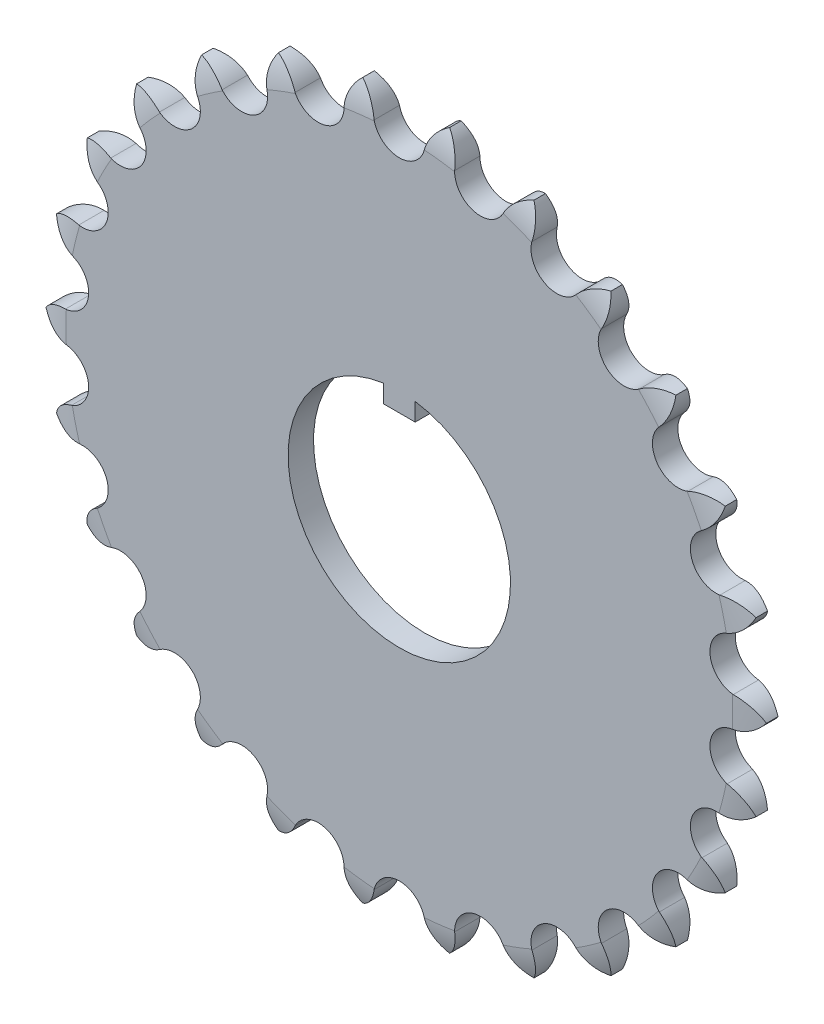
from build123d import *

# Parameters (mm, degrees)
SKETCH2_R                = 17.5
BOSS_EXTRUDE1_DEPTH      = 4
BOSS_EXTRUDE2_DEPTH      = 2
BOSS_EXTRUDE2_DEPTH_BACK = 2
SKETCH8_W                = 5
SKETCH8_H                = 7.950638129


with BuildPart() as part:
    # Sketch2 → Boss-Extrude1 (new body)
    with BuildSketch(Plane.XY):
        with BuildLine():
            ThreePointArc((3.964856262, 52.447805617), (0, 49.276), (-3.964856262, 52.447805617))
            ThreePointArc((-3.964856262, 52.447805617), (-4.989300963, 54.66856047), (-6.833064673, 56.275350576))
            ThreePointArc((-6.833064673, 56.275350576), (-8.23872192, 54.274009333), (-8.701936696, 51.872619916))
            ThreePointArc((-8.701936696, 51.872619916), (-11.792518673, 47.844128995), (-16.401226187, 49.974915495))
            ThreePointArc((-16.401226187, 49.974915495), (-17.927363809, 51.885973585), (-20.102081139, 53.004831753))
            ThreePointArc((-20.102081139, 53.004831753), (-20.987940231, 50.725250052), (-20.863004724, 48.282786095))
            ThreePointArc((-20.863004724, 48.282786095), (-22.899699026, 43.63173112), (-27.884416461, 44.597664937))
            ThreePointArc((-27.884416461, 44.597664937), (-29.823553434, 46.087962512), (-32.202837716, 46.653864773))
            ThreePointArc((-32.202837716, 46.653864773), (-32.517415745, 44.228523616), (-31.811590752, 41.886932246))
            ThreePointArc((-31.811590752, 41.886932246), (-32.676032107, 36.883615627), (-37.747065807, 36.628560198))
            ThreePointArc((-37.747065807, 36.628560198), (-39.986506538, 37.611486582), (-42.432082418, 37.591544753))
            ThreePointArc((-42.432082418, 37.591544753), (-42.157097251, 35.161396152), (-40.911402755, 33.056762149))
            ThreePointArc((-40.911402755, 33.056762149), (-40.553352976, 27.99195846), (-45.415992893, 26.53073668))
            ThreePointArc((-45.415992893, 26.53073668), (-47.825589226, 26.949167763), (-50.195328724, 26.344540791))
            ThreePointArc((-50.195328724, 26.344540791), (-49.346761499, 24.05081615), (-47.633592738, 22.305453192))
            ThreePointArc((-47.633592738, 22.305453192), (-46.073860375, 17.473510414), (-50.445507552, 14.891043181))
            ThreePointArc((-50.445507552, 14.891043181), (-52.885222508, 14.72066127), (-55.041404978, 13.566487877))
            ThreePointArc((-55.041404978, 13.566487877), (-53.668571338, 11.542490135), (-51.587491451, 10.257832372))
            ThreePointArc((-51.587491451, 10.257832372), (-48.91672248, 5.939565456), (-52.543312674, 2.385936379))
            ThreePointArc((-52.543312674, 2.385936379), (-54.871358888, 1.636643452), (-56.688674841, 0))
            ThreePointArc((-56.688674841, 0), (-54.871358888, -1.636643452), (-52.543312674, -2.385936379))
            ThreePointArc((-52.543312674, -2.385936379), (-48.91672248, -5.939565456), (-51.587491451, -10.257832372))
            ThreePointArc((-51.587491451, -10.257832372), (-53.668571338, -11.542490135), (-55.041404978, -13.566487877))
            ThreePointArc((-55.041404978, -13.566487877), (-52.885222508, -14.72066127), (-50.445507552, -14.891043181))
            ThreePointArc((-50.445507552, -14.891043181), (-46.073860375, -17.473510414), (-47.633592738, -22.305453192))
            ThreePointArc((-47.633592738, -22.305453192), (-49.346761499, -24.05081615), (-50.195328724, -26.344540791))
            ThreePointArc((-50.195328724, -26.344540791), (-47.825589226, -26.949167763), (-45.415992893, -26.53073668))
            ThreePointArc((-45.415992893, -26.53073668), (-40.553352976, -27.99195846), (-40.911402755, -33.056762149))
            ThreePointArc((-40.911402755, -33.056762149), (-42.157097251, -35.161396152), (-42.432082418, -37.591544753))
            ThreePointArc((-42.432082418, -37.591544753), (-39.986506538, -37.611486582), (-37.747065807, -36.628560198))
            ThreePointArc((-37.747065807, -36.628560198), (-32.676032107, -36.883615627), (-31.811590752, -41.886932246))
            ThreePointArc((-31.811590752, -41.886932246), (-32.517415745, -44.228523616), (-32.202837716, -46.653864773))
            ThreePointArc((-32.202837716, -46.653864773), (-29.823553434, -46.087962512), (-27.884416461, -44.597664937))
            ThreePointArc((-27.884416461, -44.597664937), (-22.899699026, -43.63173112), (-20.863004724, -48.282786095))
            ThreePointArc((-20.863004724, -48.282786095), (-20.987940231, -50.725250052), (-20.102081139, -53.004831753))
            ThreePointArc((-20.102081139, -53.004831753), (-17.927363809, -51.885973585), (-16.401226187, -49.974915495))
            ThreePointArc((-16.401226187, -49.974915495), (-11.792518673, -47.844128995), (-8.701936696, -51.872619916))
            ThreePointArc((-8.701936696, -51.872619916), (-8.23872192, -54.274009333), (-6.833064673, -56.275350576))
            ThreePointArc((-6.833064673, -56.275350576), (-4.989300963, -54.66856047), (-3.964856262, -52.447805617))
            ThreePointArc((-3.964856262, -52.447805617), (0, -49.276), (3.964856262, -52.447805617))
            ThreePointArc((3.964856262, -52.447805617), (4.989300963, -54.66856047), (6.833064673, -56.275350576))
            ThreePointArc((6.833064673, -56.275350576), (8.23872192, -54.274009333), (8.701936696, -51.872619916))
            ThreePointArc((8.701936696, -51.872619916), (11.792518673, -47.844128995), (16.401226187, -49.974915495))
            ThreePointArc((16.401226187, -49.974915495), (17.927363809, -51.885973585), (20.102081139, -53.004831753))
            ThreePointArc((20.102081139, -53.004831753), (20.987940231, -50.725250052), (20.863004724, -48.282786095))
            ThreePointArc((20.863004724, -48.282786095), (22.899699026, -43.63173112), (27.884416461, -44.597664937))
            ThreePointArc((27.884416461, -44.597664937), (29.823553434, -46.087962512), (32.202837716, -46.653864773))
            ThreePointArc((32.202837716, -46.653864773), (32.517415745, -44.228523616), (31.811590752, -41.886932246))
            ThreePointArc((31.811590752, -41.886932246), (32.676032107, -36.883615627), (37.747065807, -36.628560198))
            ThreePointArc((37.747065807, -36.628560198), (39.986506538, -37.611486582), (42.432082418, -37.591544753))
            ThreePointArc((42.432082418, -37.591544753), (42.157097251, -35.161396152), (40.911402755, -33.056762149))
            ThreePointArc((40.911402755, -33.056762149), (40.553352976, -27.99195846), (45.415992893, -26.53073668))
            ThreePointArc((45.415992893, -26.53073668), (47.825589226, -26.949167763), (50.195328724, -26.344540791))
            ThreePointArc((50.195328724, -26.344540791), (49.346761499, -24.05081615), (47.633592738, -22.305453192))
            ThreePointArc((47.633592738, -22.305453192), (46.073860375, -17.473510414), (50.445507552, -14.891043181))
            ThreePointArc((50.445507552, -14.891043181), (52.885222508, -14.72066127), (55.041404978, -13.566487877))
            ThreePointArc((55.041404978, -13.566487877), (53.668571338, -11.542490135), (51.587491451, -10.257832372))
            ThreePointArc((51.587491451, -10.257832372), (48.91672248, -5.939565456), (52.543312674, -2.385936379))
            ThreePointArc((52.543312674, -2.385936379), (54.871358888, -1.636643452), (56.688674841, 0))
            ThreePointArc((56.688674841, 0), (54.871358888, 1.636643452), (52.543312674, 2.385936379))
            ThreePointArc((52.543312674, 2.385936379), (48.91672248, 5.939565456), (51.587491451, 10.257832372))
            ThreePointArc((51.587491451, 10.257832372), (53.668571338, 11.542490135), (55.041404978, 13.566487877))
            ThreePointArc((55.041404978, 13.566487877), (52.885222508, 14.72066127), (50.445507552, 14.891043181))
            ThreePointArc((50.445507552, 14.891043181), (46.073860375, 17.473510414), (47.633592738, 22.305453192))
            ThreePointArc((47.633592738, 22.305453192), (49.346761499, 24.05081615), (50.195328724, 26.344540791))
            ThreePointArc((50.195328724, 26.344540791), (47.825589226, 26.949167763), (45.415992893, 26.53073668))
            ThreePointArc((45.415992893, 26.53073668), (40.553352976, 27.99195846), (40.911402755, 33.056762149))
            ThreePointArc((40.911402755, 33.056762149), (42.157097251, 35.161396152), (42.432082418, 37.591544753))
            ThreePointArc((42.432082418, 37.591544753), (39.986506538, 37.611486582), (37.747065807, 36.628560198))
            ThreePointArc((37.747065807, 36.628560198), (32.676032107, 36.883615627), (31.811590752, 41.886932246))
            ThreePointArc((31.811590752, 41.886932246), (32.517415745, 44.228523616), (32.202837716, 46.653864773))
            ThreePointArc((32.202837716, 46.653864773), (29.823553434, 46.087962512), (27.884416461, 44.597664937))
            ThreePointArc((27.884416461, 44.597664937), (22.899699026, 43.63173112), (20.863004724, 48.282786095))
            ThreePointArc((20.863004724, 48.282786095), (20.987940231, 50.725250052), (20.102081139, 53.004831753))
            ThreePointArc((20.102081139, 53.004831753), (17.927363809, 51.885973585), (16.401226187, 49.974915495))
            ThreePointArc((16.401226187, 49.974915495), (11.792518673, 47.844128995), (8.701936696, 51.872619916))
            ThreePointArc((8.701936696, 51.872619916), (8.23872192, 54.274009333), (6.833064673, 56.275350576))
            ThreePointArc((6.833064673, 56.275350576), (4.989300963, 54.66856047), (3.964856262, 52.447805617))
        make_face()
        Circle(SKETCH2_R, mode=Mode.SUBTRACT)
    extrude(amount=BOSS_EXTRUDE1_DEPTH)

    # Sketch7 → Cut-Revolve1 (revolve, cut)
    with BuildSketch(Plane(origin=(0, 0, 0), x_dir=(0, 0, -1), z_dir=(1, 0, 0))):
        with BuildLine():
            Line((-4, 50.419), (-7.774586271, 50.419))
            Line((-7.774586271, 50.419), (-7.774586271, 56.896))
            Line((-7.774586271, 56.896), (-2.808796476, 56.896))
            ThreePointArc((-2.808796476, 56.896), (-3.831535403, 53.736056013), (-4, 50.419))
        make_face()
        with BuildLine():
            Line((3.774586271, 56.896), (-1.191203524, 56.896))
            ThreePointArc((-1.191203524, 56.896), (-0.168464597, 53.736056013), (0, 50.419))
            Line((0, 50.419), (3.774586271, 50.419))
            Line((3.774586271, 50.419), (3.774586271, 56.896))
        make_face()
    revolve(axis=Axis((0, 0, 0), (0, 0, -1)), mode=Mode.SUBTRACT)

    # Sketch8 → Boss-Extrude2 (add, two sides: drawn at the far end of the back side and taken through both)
    with BuildSketch(Plane.XY.offset(2).offset(-BOSS_EXTRUDE2_DEPTH_BACK)):
        with Locations((0, 18.475319065)):
            Rectangle(SKETCH8_W, SKETCH8_H)
    extrude(amount=BOSS_EXTRUDE2_DEPTH + BOSS_EXTRUDE2_DEPTH_BACK)


solid = part.part
